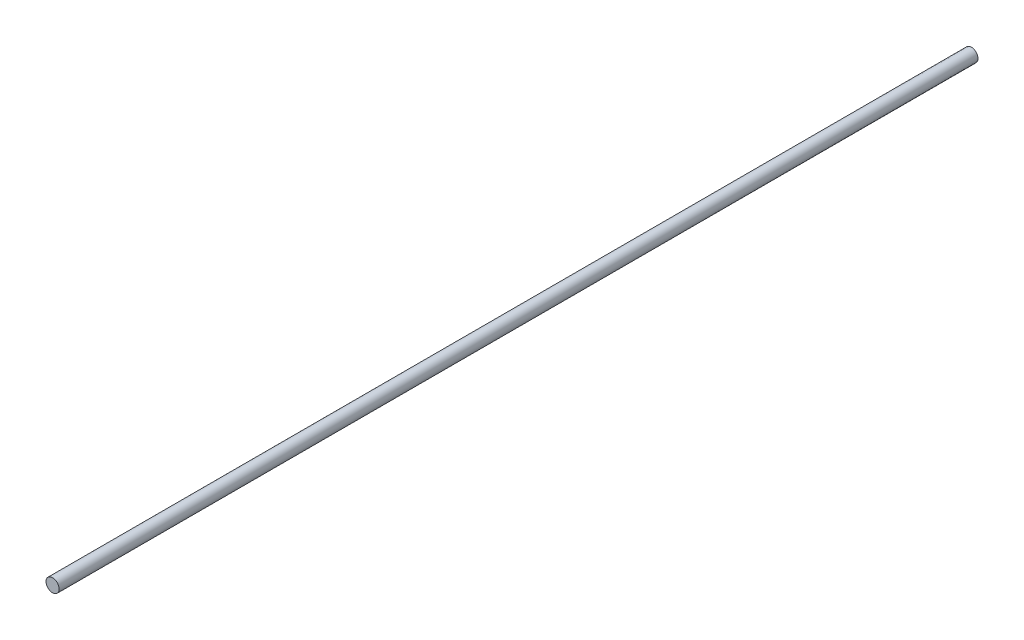
from build123d import *

# Parameters (mm, degrees)
SKETCH1_R           = 2.5
BOSS_EXTRUDE1_DEPTH = 175


with BuildPart() as part:
    # Sketch1 → Boss-Extrude1 (new, symmetric)
    with BuildSketch(Plane.XY):
        Circle(SKETCH1_R)
    extrude(amount=BOSS_EXTRUDE1_DEPTH, both=True)


solid = part.part
